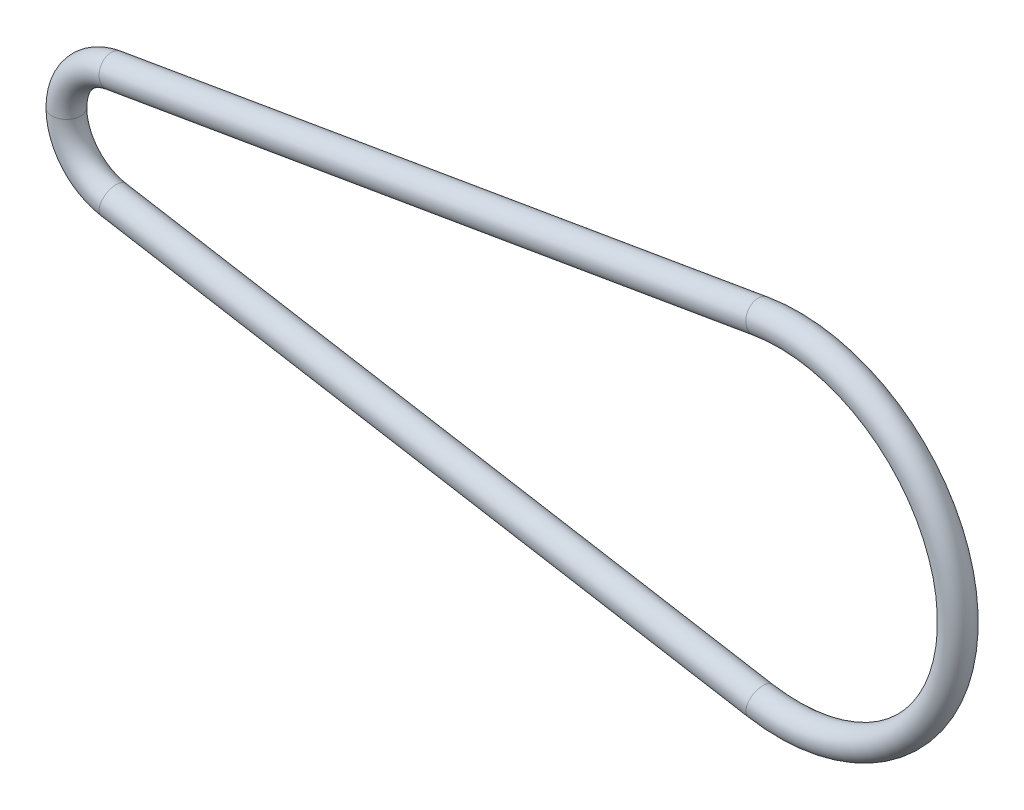
from build123d import *

# Parameters (mm, degrees)
SKETCH2_R = 1.3081


with BuildPart() as part:
    # Sweep1: sweep along a path in Sketch1
    with BuildLine(Plane.XY) as sweep1_path:
        Line((-0.868102245, 5.082597459), (57.767920416, 15.097567822))
        ThreePointArc((57.767920416, 15.097567822), (75.662768957, 0), (57.767920416, -15.097567822))
        Line((57.767920416, -15.097567822), (-0.868102245, -5.082597459))
        ThreePointArc((-0.868102245, -5.082597459), (-5.1562, 0), (-0.868102245, 5.082597459))
    # Sketch2 → Sweep1 (sweep)
    with BuildSketch(Plane(origin=(0, 0, 0), x_dir=(1, 0, 0), z_dir=(0, 1, 0))):
        with Locations((-5.1562, 0)):
            Circle(SKETCH2_R)
    sweep(path=sweep1_path.line)


solid = part.part
